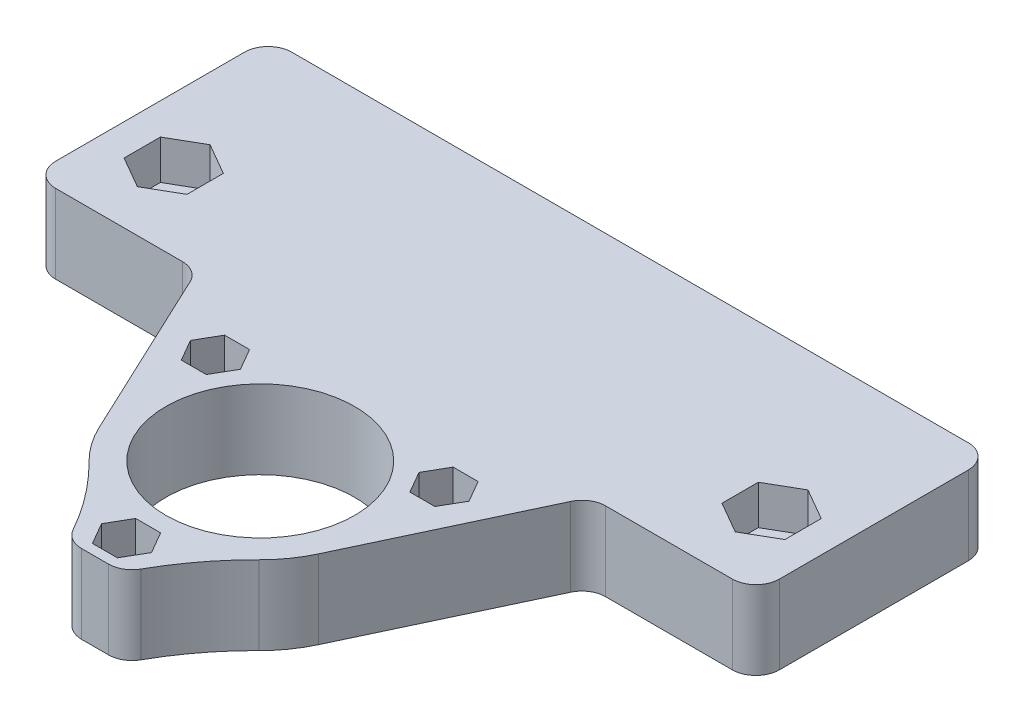
from build123d import *

# Parameters (mm, degrees)
ESQUISSE2_R             = 2.5
BOSS_EXTRU_1_DEPTH      = 10
CONG_1_R                = 3
ESQUISSE4_R             = 1.25
ENL_V_MAT_EXTRU_2_DEPTH = 109.719823399
ENL_V_MAT_EXTRU_3_DEPTH = 5


with BuildPart() as part:
    # Esquisse2 → Boss.-Extru.1 (new body)
    with BuildSketch(Plane(origin=(0, 0, 0), x_dir=(1, 0, 0), z_dir=(0, 1, 0))):
        with BuildLine():
            Line((0, -98), (-3.514709064, -98))
            ThreePointArc((-3.514709064, -98), (-6.748469646, -92.676394089), (-10.808475025, -87.952588026))
            ThreePointArc((-10.808475025, -87.952588026), (-12.561008366, -85.888384873), (-13.92457187, -83.548939995))
            Line((-13.92457187, -83.548939995), (-25, -60))
            Line((-25, -60), (-46, -60))
            Line((-46, -60), (-46, -30))
            Line((-46, -30), (0, -30))
            Line((0, -30), (0, -43.5))
            Line((0, -43.5), (0, -46.5))
            Line((0, -46.5), (0, -65))
            ThreePointArc((0, -65), (-12, -77), (0, -89))
            Line((0, -89), (0, -98))
        make_face()
        with Locations(Location((-38, -50, 0), (0, 0, 270))):
            Circle(ESQUISSE2_R, mode=Mode.SUBTRACT)
    extrude(amount=BOSS_EXTRU_1_DEPTH)

    # Congé1
    cong_1_edges = [part.edges().sort_by_distance(p)[0] for p in [
        (-46, 5, 30),
        (-3.514709064, 5, 98),
        (-25, 5, 60),
        (-46, 5, 60),
    ]]
    fillet(cong_1_edges, radius=CONG_1_R)

    # Symétrie1: part across face


with BuildPart() as part_1:
    add(part.part)
    add(part.part.mirror(Plane(origin=(0, 5, 47.5), x_dir=(0, 0, 1), z_dir=(1, 0, 0))))

    # Esquisse4 → Enlèv. mat.-Extru.2 (cut, through all)
    with BuildSketch(Plane(origin=(0, 10, 0), x_dir=(1, 0, 0), z_dir=(0, 1, 0))):
        with Locations(Location((-14.526993136, -68.170137576, 0), (0, 0, 270))):
            Circle(ESQUISSE4_R)
        with Locations(Location((0, -94, 0), (0, 0, 270))):
            Circle(ESQUISSE4_R)
        with Locations(Location((14.526993136, -68.170137576, 0), (0, 0, 90))):
            Circle(ESQUISSE4_R)
    extrude(amount=-ENL_V_MAT_EXTRU_2_DEPTH, mode=Mode.SUBTRACT)

    # Esquisse5 → Enlèv. mat.-Extru.3 (cut)
    with BuildSketch(Plane(origin=(0, 10, 0), x_dir=(1, 0, 0), z_dir=(0, 1, 0))):
        Polygon((-11.351566655, -68.170137576), (-12.939279895, -65.420137576), (-16.114706376, -65.420137576), (-17.702419616, -68.170137576), (-16.114706376, -70.920137576), (-12.939279895, -70.920137576), align=None)
        Polygon((17.702419616, -68.170137576), (16.114706376, -65.420137576), (12.939279895, -65.420137576), (11.351566655, -68.170137576), (12.939279895, -70.920137576), (16.114706376, -70.920137576), align=None)
        Polygon((3.175426481, -94), (1.58771324, -91.25), (-1.58771324, -91.25), (-3.175426481, -94), (-1.58771324, -96.75), (1.58771324, -96.75), align=None)
        Polygon((-34, -47.690598923), (-38, -45.381197846), (-42, -47.690598923), (-42, -52.309401077), (-38, -54.618802154), (-34, -52.309401077), align=None)
        Polygon((42, -52.309401077), (42, -47.690598923), (38, -45.381197846), (34, -47.690598923), (34, -52.309401077), (38, -54.618802154), align=None)
    extrude(amount=-ENL_V_MAT_EXTRU_3_DEPTH, mode=Mode.SUBTRACT)


solid = part_1.part
